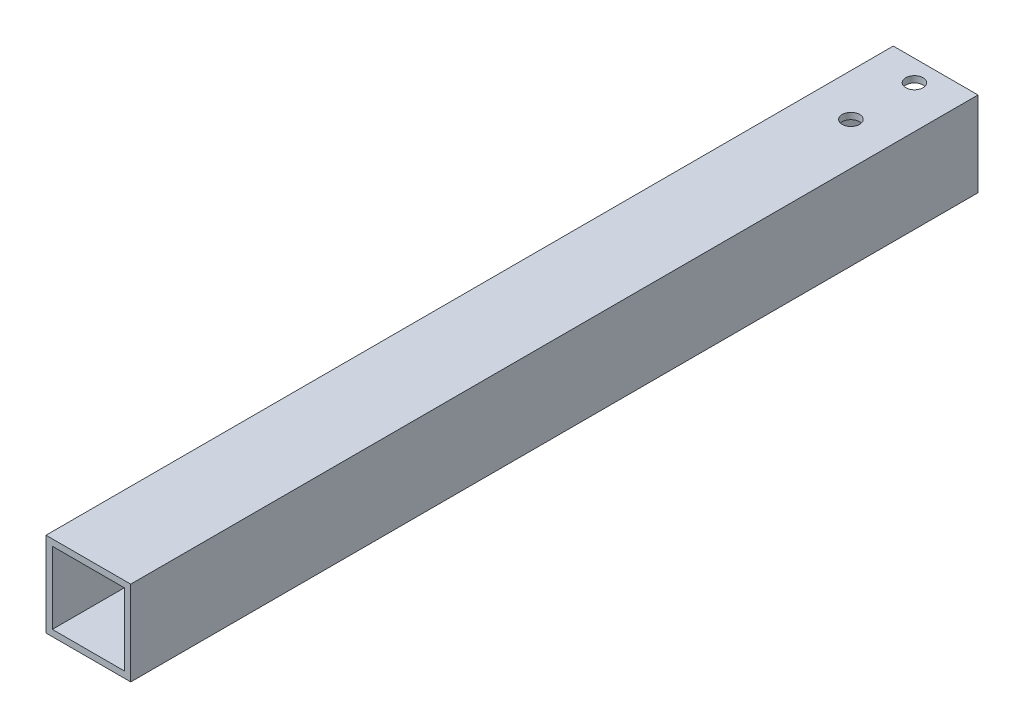
from build123d import *

# Parameters (mm, degrees)
SKETCH_1_W          = 20
SKETCH_1_H          = 20
SKETCH_1_W_2        = 17
SKETCH_1_H_2        = 17
EXTRUDE_1_DEPTH     = 200
SKETCH_3_R          = 2.05
CUT_EXTRUDE_1_DEPTH = 24


with BuildPart() as part:
    # 草图1 → 凸台-拉伸1 (new body)
    with BuildSketch(Plane.XY):
        Rectangle(SKETCH_1_W, SKETCH_1_H)
        Rectangle(SKETCH_1_W_2, SKETCH_1_H_2, mode=Mode.SUBTRACT)
    extrude(amount=EXTRUDE_1_DEPTH)

    # 草图3 → 切除-拉伸1 (cut)
    with BuildSketch(Plane(origin=(0, 10, 0), x_dir=(1, 0, 0), z_dir=(0, 1, 0))):
        with Locations(Location((0, -5, 0), (0, 0, 270))):
            Circle(SKETCH_3_R)
        with Locations(Location((0, -20, 0), (0, 0, 270))):
            Circle(SKETCH_3_R)
    extrude(amount=-CUT_EXTRUDE_1_DEPTH, mode=Mode.SUBTRACT)


solid = part.part
